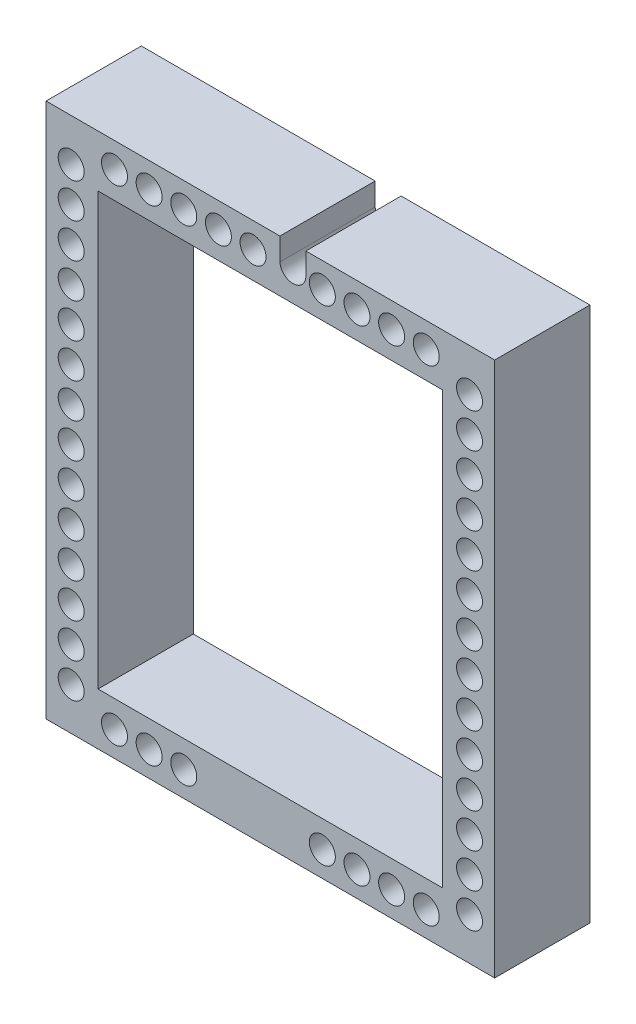
from build123d import *

# Parameters (mm, degrees)
POGO_R              = 0.75
POGO_W              = 19.9
POGO_H              = 24.9
BOSS_EXTRUDE1_DEPTH = 5.5


with BuildPart() as part:
    # pogo → Boss-Extrude1 (new body)
    with BuildSketch(Plane.XY):
        with BuildLine():
            Line((-12.95, 15.45), (0.55, 15.45))
            Line((0.55, 15.45), (0.55, 14.15))
            ThreePointArc((0.55, 14.15), (1.35, 13.45), (2.05, 14.25))
            Line((2.05, 14.25), (2.05, 15.45))
            Line((2.05, 15.45), (12.95, 15.45))
            Line((12.95, 15.45), (12.95, -15.45))
            Line((12.95, -15.45), (-12.95, -15.45))
            Line((-12.95, -15.45), (-12.95, 15.45))
        make_face()
        with Locations((-11.5, 13)):
            Circle(POGO_R, mode=Mode.SUBTRACT)
        with Locations((11.5, 13)):
            Circle(POGO_R, mode=Mode.SUBTRACT)
        with Locations((11.5, 11)):
            Circle(POGO_R, mode=Mode.SUBTRACT)
        with Locations((11.5, 9)):
            Circle(POGO_R, mode=Mode.SUBTRACT)
        with Locations((11.5, 7)):
            Circle(POGO_R, mode=Mode.SUBTRACT)
        with Locations((11.5, 5)):
            Circle(POGO_R, mode=Mode.SUBTRACT)
        with Locations((11.5, 3)):
            Circle(POGO_R, mode=Mode.SUBTRACT)
        with Locations((11.5, 1)):
            Circle(POGO_R, mode=Mode.SUBTRACT)
        with Locations((11.5, -1)):
            Circle(POGO_R, mode=Mode.SUBTRACT)
        with Locations((11.5, -3)):
            Circle(POGO_R, mode=Mode.SUBTRACT)
        with Locations((11.5, -5)):
            Circle(POGO_R, mode=Mode.SUBTRACT)
        with Locations((11.5, -7)):
            Circle(POGO_R, mode=Mode.SUBTRACT)
        with Locations((11.5, -9)):
            Circle(POGO_R, mode=Mode.SUBTRACT)
        with Locations((11.5, -11)):
            Circle(POGO_R, mode=Mode.SUBTRACT)
        with Locations((11.5, -13)):
            Circle(POGO_R, mode=Mode.SUBTRACT)
        with Locations((-11.5, 11)):
            Circle(POGO_R, mode=Mode.SUBTRACT)
        with Locations((-11.5, 9)):
            Circle(POGO_R, mode=Mode.SUBTRACT)
        with Locations((-11.5, 7)):
            Circle(POGO_R, mode=Mode.SUBTRACT)
        with Locations((-11.5, 5)):
            Circle(POGO_R, mode=Mode.SUBTRACT)
        with Locations((-11.5, 3)):
            Circle(POGO_R, mode=Mode.SUBTRACT)
        with Locations((-11.5, 1)):
            Circle(POGO_R, mode=Mode.SUBTRACT)
        with Locations((-11.5, -1)):
            Circle(POGO_R, mode=Mode.SUBTRACT)
        with Locations((-11.5, -3)):
            Circle(POGO_R, mode=Mode.SUBTRACT)
        with Locations((-11.5, -5)):
            Circle(POGO_R, mode=Mode.SUBTRACT)
        with Locations((-11.5, -7)):
            Circle(POGO_R, mode=Mode.SUBTRACT)
        with Locations((-11.5, -9)):
            Circle(POGO_R, mode=Mode.SUBTRACT)
        with Locations((-11.5, -11)):
            Circle(POGO_R, mode=Mode.SUBTRACT)
        with Locations((-11.5, -13)):
            Circle(POGO_R, mode=Mode.SUBTRACT)
        with Locations((-9, 14)):
            Circle(POGO_R, mode=Mode.SUBTRACT)
        with Locations((-7, 14)):
            Circle(POGO_R, mode=Mode.SUBTRACT)
        with Locations((-5, 14)):
            Circle(POGO_R, mode=Mode.SUBTRACT)
        with Locations((-3, 14)):
            Circle(POGO_R, mode=Mode.SUBTRACT)
        with Locations((-1, 14)):
            Circle(POGO_R, mode=Mode.SUBTRACT)
        with Locations((3, 14)):
            Circle(POGO_R, mode=Mode.SUBTRACT)
        with Locations((5, 14)):
            Circle(POGO_R, mode=Mode.SUBTRACT)
        with Locations((7, 14)):
            Circle(POGO_R, mode=Mode.SUBTRACT)
        with Locations((9, 14)):
            Circle(POGO_R, mode=Mode.SUBTRACT)
        with Locations((-7, -14)):
            Circle(POGO_R, mode=Mode.SUBTRACT)
        with Locations((-5, -14)):
            Circle(POGO_R, mode=Mode.SUBTRACT)
        with Locations((3, -14)):
            Circle(POGO_R, mode=Mode.SUBTRACT)
        with Locations((5, -14)):
            Circle(POGO_R, mode=Mode.SUBTRACT)
        with Locations((7, -14)):
            Circle(POGO_R, mode=Mode.SUBTRACT)
        with Locations((9, -14)):
            Circle(POGO_R, mode=Mode.SUBTRACT)
        with Locations((-9, -14)):
            Circle(POGO_R, mode=Mode.SUBTRACT)
        Rectangle(POGO_W, POGO_H, mode=Mode.SUBTRACT)
    extrude(amount=BOSS_EXTRUDE1_DEPTH)


solid = part.part
